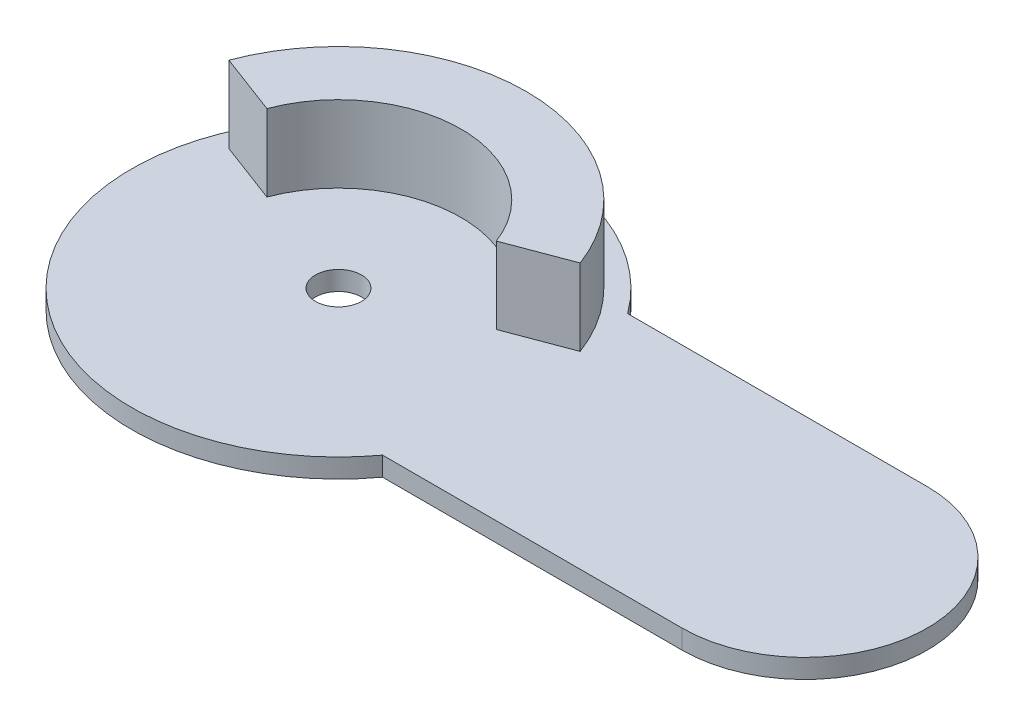
from build123d import *

# Parameters (mm, degrees)
BOSS_EXTRUDE1_DEPTH = 10
SKETCH2_R           = 3
BOSS_EXTRUDE2_DEPTH = 2.5
CUT_EXTRUDE1_DEPTH  = 10


with BuildPart() as part:
    # Sketch1 → Boss-Extrude1 (new body)
    with BuildSketch(Plane(origin=(0, 0, 0), x_dir=(1, 0, 0), z_dir=(0, 1, 0))):
        with BuildLine():
            Line((-22.931089862, 8.626419753), (-14.975405624, 5.633580247))
            ThreePointArc((-14.975405624, 5.633580247), (0, 16), (14.975405624, 5.633580247))
            Line((14.975405624, 5.633580247), (22.931089862, 8.626419753))
            ThreePointArc((22.931089862, 8.626419753), (0, 24.5), (-22.931089862, 8.626419753))
        make_face()
    extrude(amount=BOSS_EXTRUDE1_DEPTH)

    # Sketch2 → Boss-Extrude2 (add)
    with BuildSketch(Plane.XZ):
        with BuildLine():
            Line((76.870427411, -16), (76.870427411, 16))
            Line((76.870427411, 16), (21.748563171, 16))
            ThreePointArc((21.748563171, 16), (12.186057607, 24.093567606), (0, 27))
            ThreePointArc((0, 27), (-27, 0), (0, -27))
            ThreePointArc((0, -27), (12.186057607, -24.093567606), (21.748563171, -16))
            Line((21.748563171, -16), (76.870427411, -16))
        make_face()
        with Locations(Location((0, 0, 0), (0, 0, 270))):
            Circle(SKETCH2_R, mode=Mode.SUBTRACT)
    extrude(amount=BOSS_EXTRUDE2_DEPTH)

    # Sketch3 → Cut-Extrude1 (cut)
    with BuildSketch(Plane(origin=(0, 0, 0), x_dir=(1, 0, 0), z_dir=(0, 1, 0))):
        with BuildLine():
            Line((76.870427411, 16), (60.870427411, 16))
            ThreePointArc((60.870427411, 16), (72.184135957, 11.313708452), (76.870427411, -1.33e-07))
            Line((76.870427411, -1.33e-07), (76.870427411, 16))
        make_face()
        with BuildLine():
            Line((76.870427411, -16), (76.870427411, -1.33e-07))
            ThreePointArc((76.870427411, -1.33e-07), (72.184135863, -11.313708546), (60.870427411, -16))
            Line((60.870427411, -16), (76.870427411, -16))
        make_face()
    extrude(amount=-CUT_EXTRUDE1_DEPTH, mode=Mode.SUBTRACT)


solid = part.part
